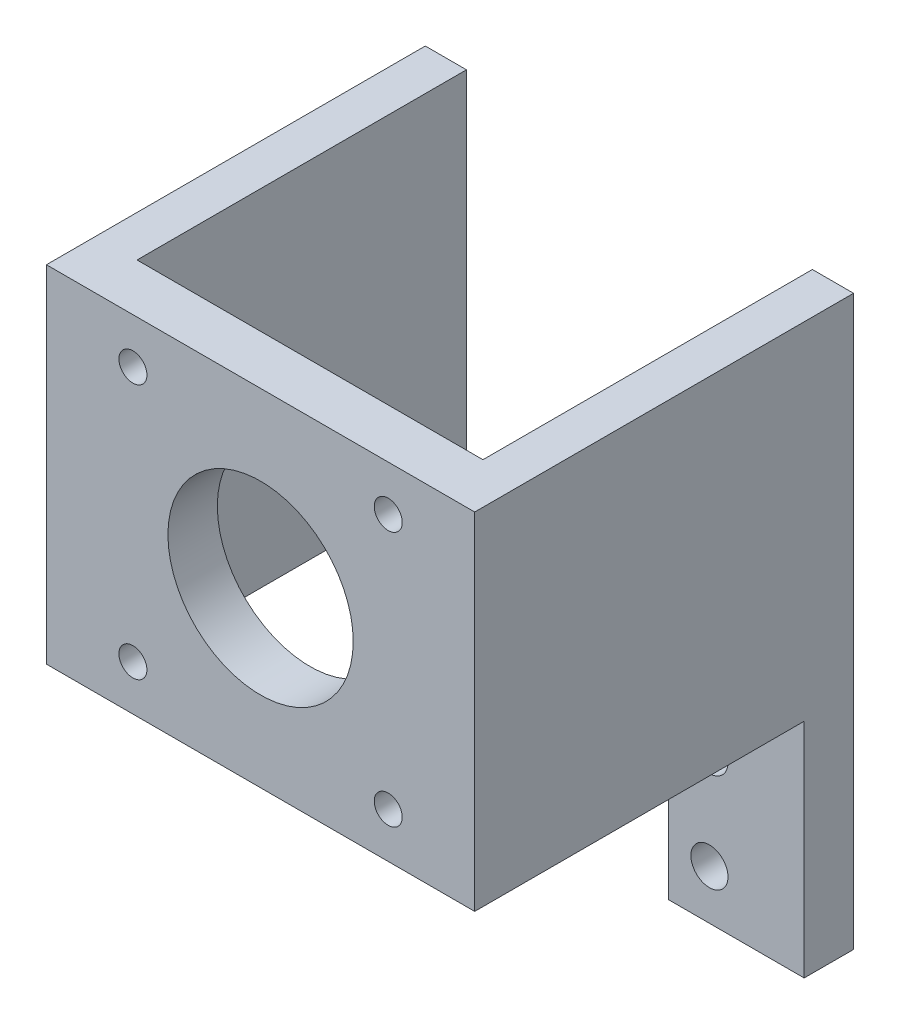
from build123d import *

# Parameters (mm, degrees)
EXTRUDE_START               = 40
SKETCH_1013_W               = 52
SKETCH_1013_H               = 42
EXTRUDE_1127_DEPTH          = 6
SKETCH_1179_W               = 5
SKETCH_1179_H               = 42
EXTRUDE_1393_DEPTH          = 40
SKETCH_1445_W               = 16.5
SKETCH_1445_H               = 27
EXTRUDE_1760_DEPTH          = 6
CUT_EXTRUDE_1818_DEPTH      = 72.38627319
CUT_EXTRUDE_1818_DEPTH_BACK = 72.38627319
SKETCH_1809_R               = 11.25
SKETCH_1809_R_2             = 1.7
CUT_EXTRUDE_1864_DEPTH      = 72.38627319
CUT_EXTRUDE_1864_DEPTH_BACK = 72.38627319
SKETCH_1856_R               = 2.25


with BuildPart() as part:
    # Sketch 1013 → Extrude 1127 (new body)
    with BuildSketch(Plane.XY.offset(EXTRUDE_START)):
        Rectangle(SKETCH_1013_W, SKETCH_1013_H)
    extrude(amount=EXTRUDE_1127_DEPTH)

    # Sketch 1179 → Extrude 1393 (add)
    with BuildSketch(Plane.XY):
        with Locations((-23.5, 0)):
            Rectangle(SKETCH_1179_W, SKETCH_1179_H)
        with Locations((23.5, 0)):
            Rectangle(SKETCH_1179_W, SKETCH_1179_H)
    extrude(amount=EXTRUDE_1393_DEPTH)

    # Sketch 1445 → Extrude 1760 (add)
    with BuildSketch(Plane.XY):
        with Locations((-17.75, -34.5)):
            Rectangle(SKETCH_1445_W, SKETCH_1445_H)
        with Locations((17.75, -34.5)):
            Rectangle(SKETCH_1445_W, SKETCH_1445_H)
    extrude(amount=EXTRUDE_1760_DEPTH)

    # Sketch 1809 → Cut-Extrude 1818 (cut, two sides: drawn at the far end of the back side and taken through both)
    with BuildSketch(Plane.XY.offset(-CUT_EXTRUDE_1818_DEPTH_BACK)):
        Circle(SKETCH_1809_R)
        with Locations((-15.5, -15.5)):
            Circle(SKETCH_1809_R_2)
        with Locations((-15.5, 15.5)):
            Circle(SKETCH_1809_R_2)
        with Locations((15.5, -15.5)):
            Circle(SKETCH_1809_R_2)
        with Locations((15.5, 15.5)):
            Circle(SKETCH_1809_R_2)
    extrude(amount=CUT_EXTRUDE_1818_DEPTH + CUT_EXTRUDE_1818_DEPTH_BACK, mode=Mode.SUBTRACT)

    # Sketch 1856 → Cut-Extrude 1864 (cut, two sides: drawn at the far end of the back side and taken through both)
    with BuildSketch(Plane.XY.offset(-CUT_EXTRUDE_1864_DEPTH_BACK)):
        with Locations((-14.5, -30)):
            Circle(SKETCH_1856_R)
        with Locations((-14.5, -42)):
            Circle(SKETCH_1856_R)
        with Locations((14.5, -30)):
            Circle(SKETCH_1856_R)
        with Locations((14.5, -42)):
            Circle(SKETCH_1856_R)
    extrude(amount=CUT_EXTRUDE_1864_DEPTH + CUT_EXTRUDE_1864_DEPTH_BACK, mode=Mode.SUBTRACT)


solid = part.part
